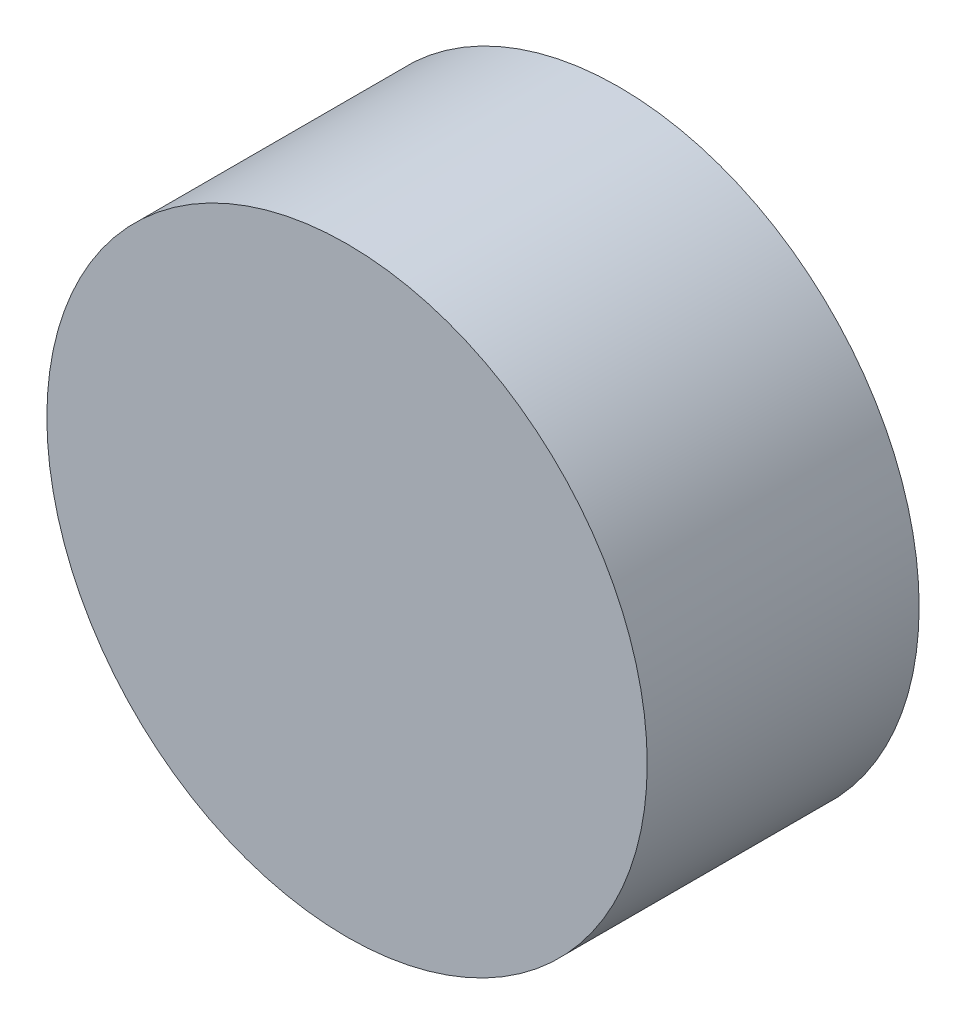
from build123d import *

# Parameters (mm, degrees)
CROQUIS1_R              = 17
SALIENTE_EXTRUIR1_DEPTH = 15.4


with BuildPart() as part:
    # Croquis1 → Saliente-Extruir1 (new body)
    with BuildSketch(Plane.XY):
        with Locations(Location((0, 0, 0), (0, 0, 180))):
            Circle(CROQUIS1_R)
    extrude(amount=SALIENTE_EXTRUIR1_DEPTH)


solid = part.part
